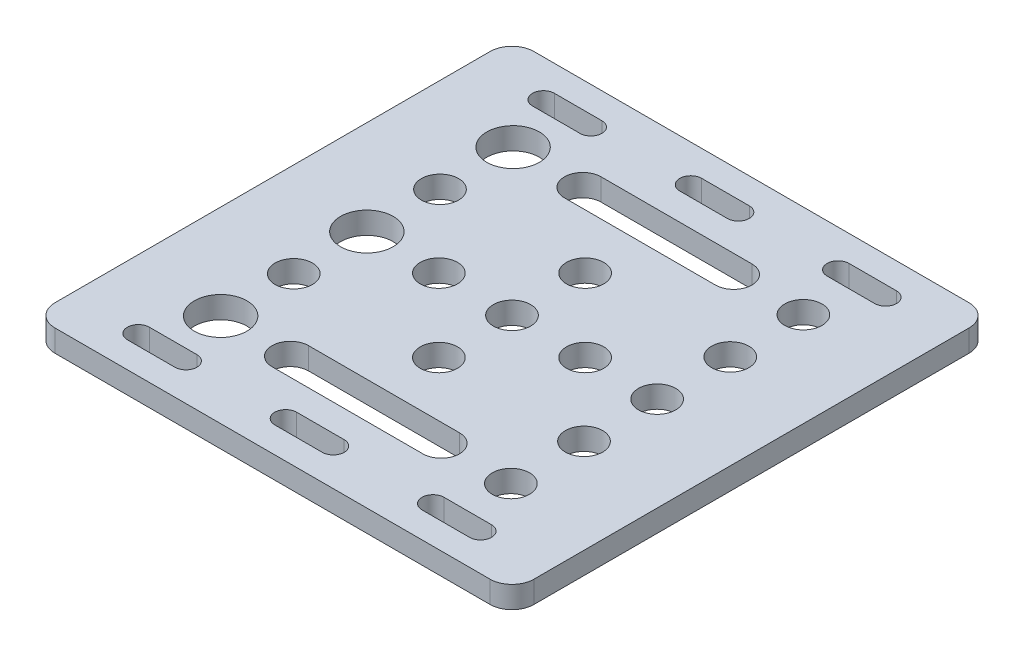
from build123d import *

# Parameters (mm, degrees)
SKETCH1_R           = 2.55
SKETCH1_R_2         = 3.6
BOSS_EXTRUDE1_DEPTH = 3


with BuildPart() as part:
    # Sketch1 → Boss-Extrude1 (new body)
    with BuildSketch(Plane(origin=(0, 0, 0), x_dir=(1, 0, 0), z_dir=(0, 1, 0))):
        with BuildLine():
            Line((29.75, -32.75), (-29.75, -32.75))
            ThreePointArc((-29.75, -32.75), (-31.871320344, -31.871320344), (-32.75, -29.75))
            Line((-32.75, -29.75), (-32.75, 29.75))
            ThreePointArc((-32.75, 29.75), (-31.871320344, 31.871320344), (-29.75, 32.75))
            Line((-29.75, 32.75), (29.75, 32.75))
            ThreePointArc((29.75, 32.75), (31.871320344, 31.871320344), (32.75, 29.75))
            Line((32.75, 29.75), (32.75, -29.75))
            ThreePointArc((32.75, -29.75), (31.871320344, -31.871320344), (29.75, -32.75))
        make_face()
        with Locations(Location((0, 10, 0), (0, 0, 270))):
            Circle(SKETCH1_R, mode=Mode.SUBTRACT)
        with Locations(Location((0, 0, 0), (0, 0, 270))):
            Circle(SKETCH1_R, mode=Mode.SUBTRACT)
        with Locations(Location((10, 0, 0), (0, 0, 270))):
            Circle(SKETCH1_R, mode=Mode.SUBTRACT)
        with Locations(Location((-10, 0, 0), (0, 0, 90))):
            Circle(SKETCH1_R, mode=Mode.SUBTRACT)
        with Locations(Location((-19.85, 20, 0), (0, 0, 270))):
            Circle(SKETCH1_R_2, mode=Mode.SUBTRACT)
        with Locations(Location((-19.85, 0, 0), (0, 0, 270))):
            Circle(SKETCH1_R_2, mode=Mode.SUBTRACT)
        with Locations(Location((-19.85, -20, 0), (0, 0, 90))):
            Circle(SKETCH1_R_2, mode=Mode.SUBTRACT)
        with Locations(Location((-19.85, 10, 0), (0, 0, 270))):
            Circle(SKETCH1_R, mode=Mode.SUBTRACT)
        with Locations(Location((19.85, 20, 0), (0, 0, 270))):
            Circle(SKETCH1_R, mode=Mode.SUBTRACT)
        with Locations(Location((19.85, 0, 0), (0, 0, 270))):
            Circle(SKETCH1_R, mode=Mode.SUBTRACT)
        with Locations(Location((19.85, -20, 0), (0, 0, 90))):
            Circle(SKETCH1_R, mode=Mode.SUBTRACT)
        with Locations(Location((0, -10, 0), (0, 0, 90))):
            Circle(SKETCH1_R, mode=Mode.SUBTRACT)
        with Locations(Location((19.85, 10, 0), (0, 0, 90))):
            Circle(SKETCH1_R, mode=Mode.SUBTRACT)
        with Locations(Location((19.85, -10, 0), (0, 0, 270))):
            Circle(SKETCH1_R, mode=Mode.SUBTRACT)
        with Locations(Location((-19.85, -10, 0), (0, 0, 90))):
            Circle(SKETCH1_R, mode=Mode.SUBTRACT)
        with BuildLine():
            Line((10.32, 17.5), (-10.32, 17.5))
            ThreePointArc((-10.32, 17.5), (-12.82, 20), (-10.32, 22.5))
            Line((-10.32, 22.5), (10.32, 22.5))
            ThreePointArc((10.32, 22.5), (12.82, 20), (10.32, 17.5))
        make_face(mode=Mode.SUBTRACT)
        with BuildLine():
            Line((3.25, 26.2), (-3.25, 26.2))
            ThreePointArc((-3.25, 26.2), (-4.75, 27.7), (-3.25, 29.2))
            Line((-3.25, 29.2), (3.25, 29.2))
            ThreePointArc((3.25, 29.2), (4.75, 27.7), (3.25, 26.2))
        make_face(mode=Mode.SUBTRACT)
        with BuildLine():
            Line((-16.9, 26.2), (-23.4, 26.2))
            ThreePointArc((-23.4, 26.2), (-24.9, 27.7), (-23.4, 29.2))
            Line((-23.4, 29.2), (-16.9, 29.2))
            ThreePointArc((-16.9, 29.2), (-15.4, 27.7), (-16.9, 26.2))
        make_face(mode=Mode.SUBTRACT)
        with BuildLine():
            Line((16.9, 26.2), (23.4, 26.2))
            ThreePointArc((23.4, 26.2), (24.9, 27.7), (23.4, 29.2))
            Line((23.4, 29.2), (16.9, 29.2))
            ThreePointArc((16.9, 29.2), (15.4, 27.7), (16.9, 26.2))
        make_face(mode=Mode.SUBTRACT)
        with BuildLine():
            Line((10.32, -17.5), (-10.32, -17.5))
            ThreePointArc((-10.32, -17.5), (-12.82, -20), (-10.32, -22.5))
            Line((-10.32, -22.5), (10.32, -22.5))
            ThreePointArc((10.32, -22.5), (12.82, -20), (10.32, -17.5))
        make_face(mode=Mode.SUBTRACT)
        with BuildLine():
            Line((-16.9, -26.2), (-23.4, -26.2))
            ThreePointArc((-23.4, -26.2), (-24.9, -27.7), (-23.4, -29.2))
            Line((-23.4, -29.2), (-16.9, -29.2))
            ThreePointArc((-16.9, -29.2), (-15.4, -27.7), (-16.9, -26.2))
        make_face(mode=Mode.SUBTRACT)
        with BuildLine():
            Line((3.25, -26.2), (-3.25, -26.2))
            ThreePointArc((-3.25, -26.2), (-4.75, -27.7), (-3.25, -29.2))
            Line((-3.25, -29.2), (3.25, -29.2))
            ThreePointArc((3.25, -29.2), (4.75, -27.7), (3.25, -26.2))
        make_face(mode=Mode.SUBTRACT)
        with BuildLine():
            Line((16.9, -26.2), (23.4, -26.2))
            ThreePointArc((23.4, -26.2), (24.9, -27.7), (23.4, -29.2))
            Line((23.4, -29.2), (16.9, -29.2))
            ThreePointArc((16.9, -29.2), (15.4, -27.7), (16.9, -26.2))
        make_face(mode=Mode.SUBTRACT)
    extrude(amount=BOSS_EXTRUDE1_DEPTH)


solid = part.part
